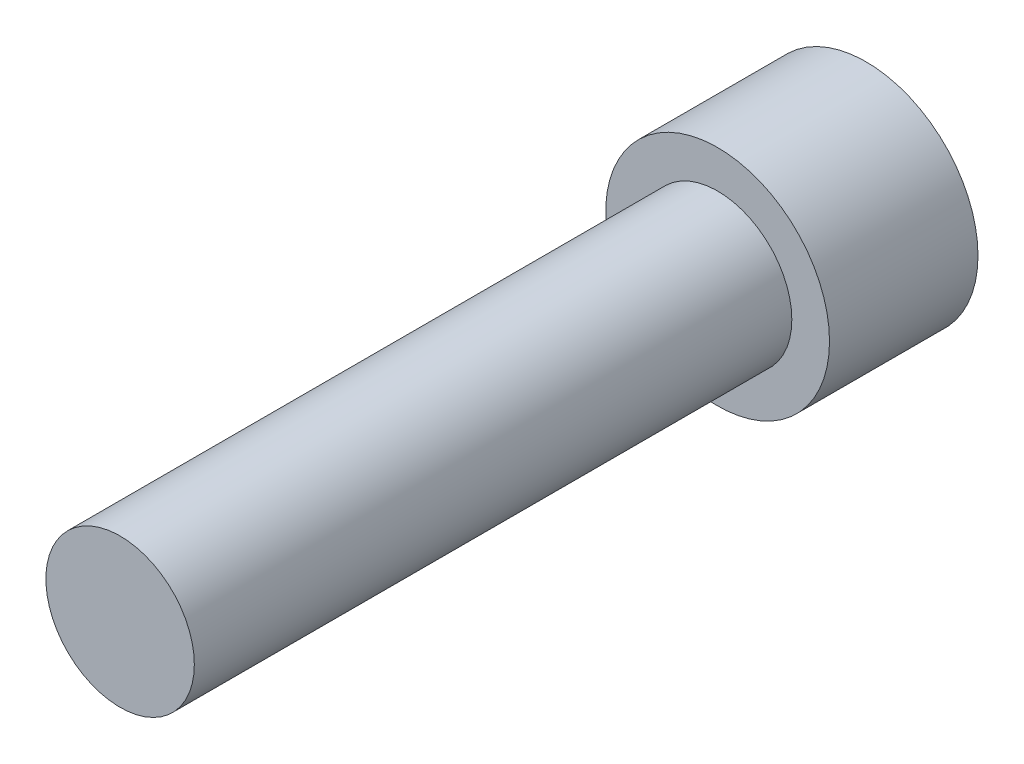
from build123d import *

# Parameters (mm, degrees)
SKETCH1_R   = 5.955
HEAD_DEPTH  = 7.9
SKETCH2_R   = 3.95
SHANK_DEPTH = 31.79


with BuildPart() as part:
    # Sketch1 → Head (new body)
    with BuildSketch(Plane.XY):
        Circle(SKETCH1_R)
    extrude(amount=HEAD_DEPTH)

    # Sketch2 → Shank (add)
    with BuildSketch(Plane.XY.offset(7.9)):
        Circle(SKETCH2_R)
    extrude(amount=SHANK_DEPTH)


solid = part.part
